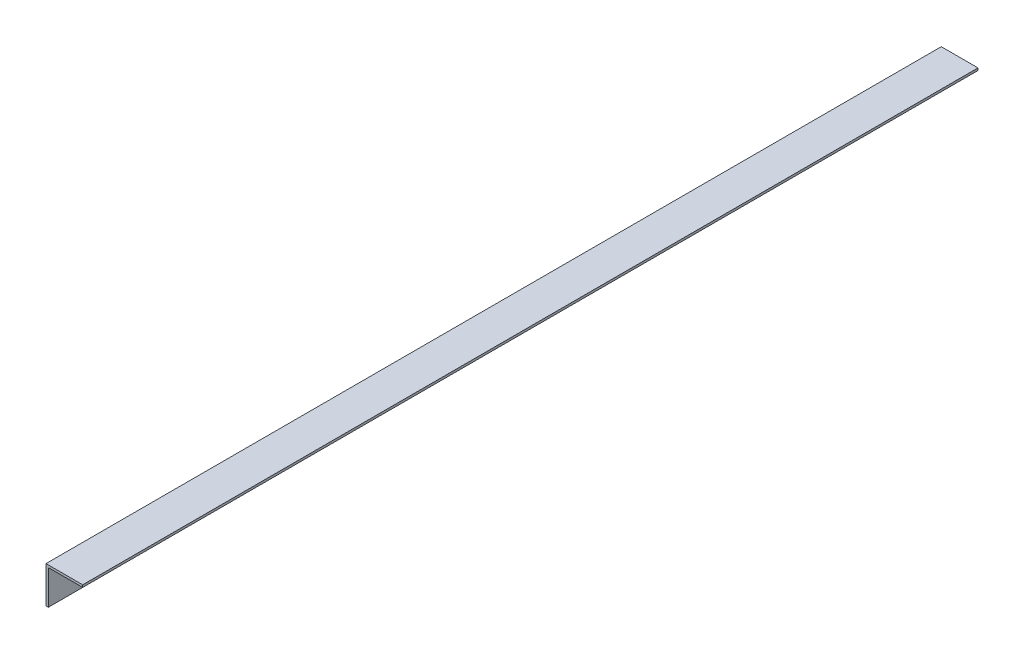
from build123d import *

# Parameters (mm, degrees)
PRESS_TEPSI_RAFI_KOSEBENT_SOL_1_START = -20
PRESS_TEPSI_RAFI_KOSEBENT_SOL_1_DEPTH = 780


with BuildPart() as part:
    # Sketch1 → PRESS_tepsi_rafi_kosebent_sol_1 (new body)
    with BuildSketch(Plane.XY.offset(PRESS_TEPSI_RAFI_KOSEBENT_SOL_1_START)):
        Polygon((38, 1042), (40, 1042), (40, 1072), (70, 1072), (70, 1074), (38, 1074), align=None)
    extrude(amount=-PRESS_TEPSI_RAFI_KOSEBENT_SOL_1_DEPTH)


solid = part.part
